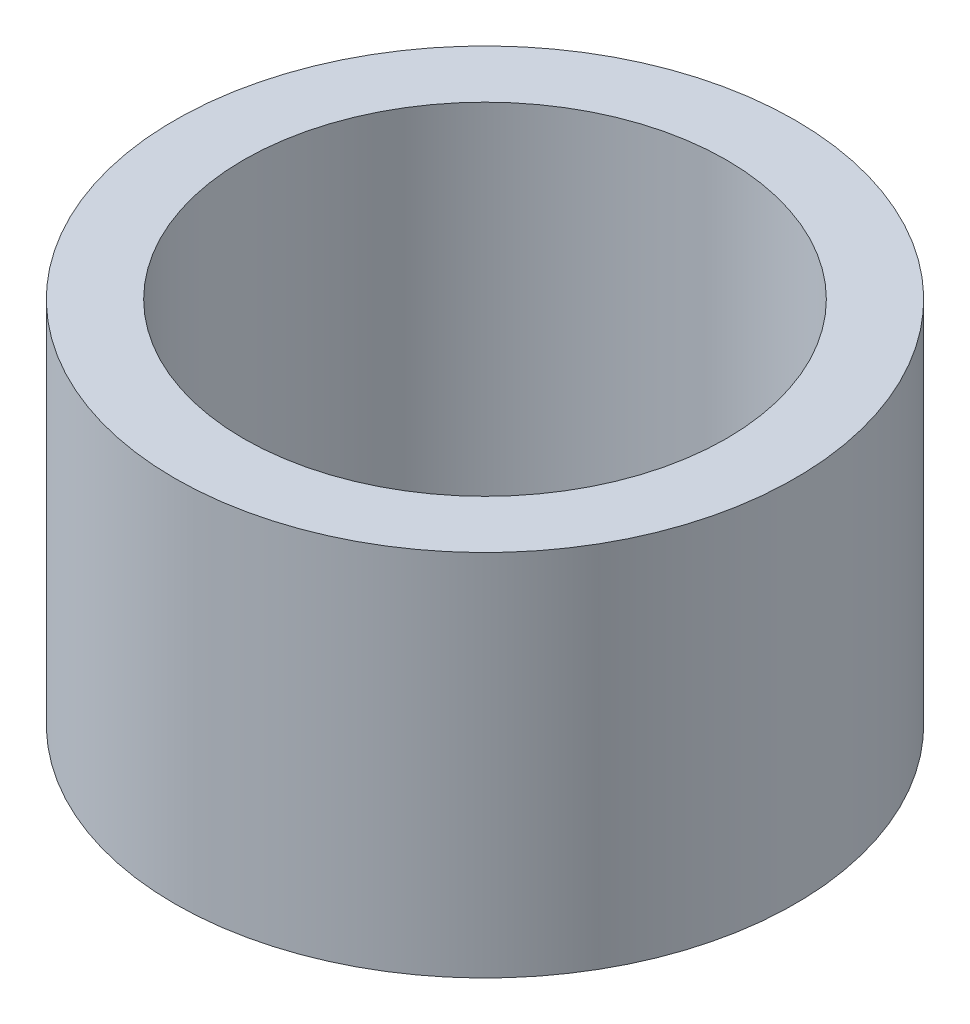
from build123d import *

# Parameters (mm, degrees)
SKETCH1_R           = 5.3975
SKETCH1_R_2         = 4.19989
BOSS_EXTRUDE1_DEPTH = 6.411459999


with BuildPart() as part:
    # Sketch1 → Boss-Extrude1 (new body)
    with BuildSketch(Plane(origin=(0, 0, 0), x_dir=(1, 0, 0), z_dir=(0, 1, 0))):
        with Locations(Location((0, 0, 0), (0, 0, 270))):
            Circle(SKETCH1_R)
        with Locations(Location((0, 0, 0), (0, 0, 270))):
            Circle(SKETCH1_R_2, mode=Mode.SUBTRACT)
    extrude(amount=BOSS_EXTRUDE1_DEPTH)


solid = part.part
